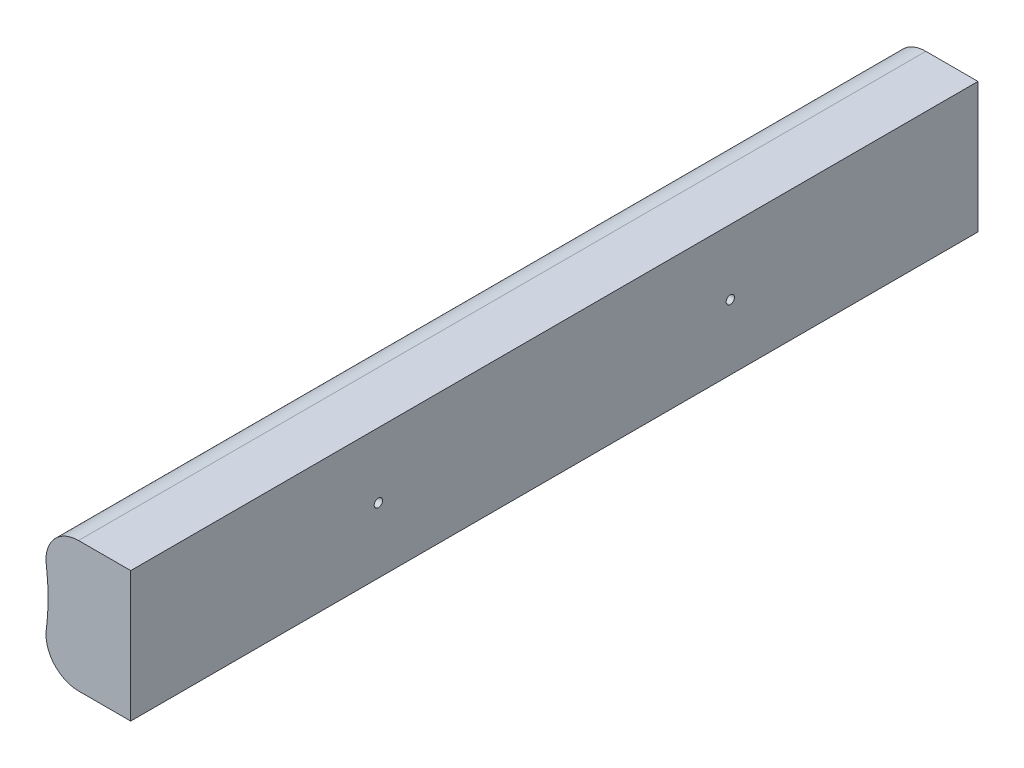
from build123d import *

# Parameters (mm, degrees)
EXTRUDE1_DEPTH               = 412.75
A_0_234_DIAMETER_HOLE1_D     = 8.128
A_0_234_DIAMETER_HOLE1_DEPTH = 19.05
A_0_234_DIAMETER_HOLE1_TIP   = 2.441897556


with BuildPart() as part:
    # Sketch1 → Extrude1 (new, symmetric)
    with BuildSketch(Plane.XY):
        with BuildLine():
            Line((-81.45600692, -19.8133218), (-82.370570719, -28.379308014))
            ThreePointArc((-82.370570719, -28.379308014), (-74.412305802, -52.975492096), (-50.8, -63.5))
            Line((-50.8, -63.5), (0, -63.5))
            Line((0, -63.5), (0, 63.5))
            Line((0, 63.5), (-50.8, 63.5))
            ThreePointArc((-50.8, 63.5), (-74.412305802, 52.975492096), (-82.370570719, 28.379308014))
            Line((-82.370570719, 28.379308014), (-81.45600692, 19.8133218))
            ThreePointArc((-81.45600692, 19.8133218), (-80.401300618, 0), (-81.45600692, -19.8133218))
        make_face()
    extrude(amount=EXTRUDE1_DEPTH, both=True)

    # A (0.234) Diameter Hole1
    with Locations(Plane(origin=(0, 0, 171.45), x_dir=(0, 1, 0), z_dir=(1, 0, 0))):
        with Locations((0, 0), (0, -342.9)):
            Hole(A_0_234_DIAMETER_HOLE1_D / 2, depth=A_0_234_DIAMETER_HOLE1_DEPTH)
            with Locations((0, 0, -(A_0_234_DIAMETER_HOLE1_DEPTH + A_0_234_DIAMETER_HOLE1_TIP / 2))):  # 118° drill point
                Cone(0, A_0_234_DIAMETER_HOLE1_D / 2, A_0_234_DIAMETER_HOLE1_TIP, mode=Mode.SUBTRACT)


solid = part.part
